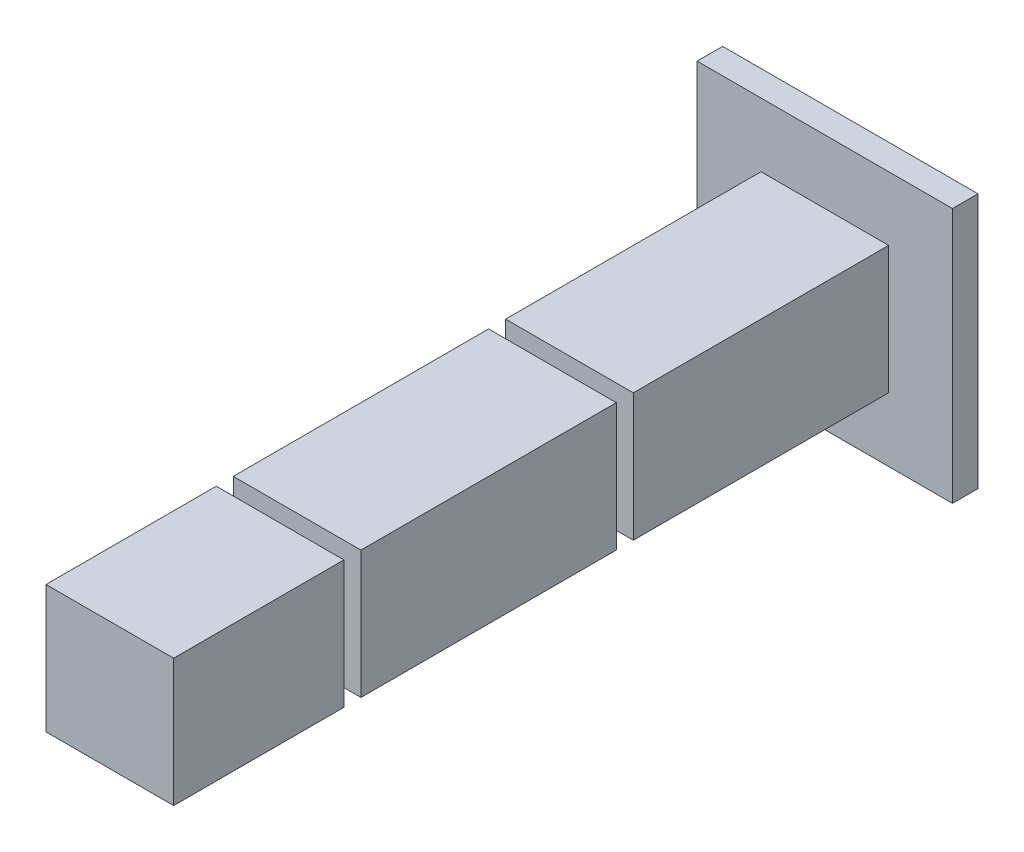
from build123d import *

# Parameters (mm, degrees)
SKETCH1_W           = 150
SKETCH1_H           = 15
BOSS_EXTRUDE1_DEPTH = 150
SKETCH2_W           = 75
SKETCH2_H           = 75
BOSS_EXTRUDE2_DEPTH = 150
SKETCH3_W           = 30
SKETCH3_H           = 30
BOSS_EXTRUDE3_DEPTH = 10
SKETCH4_W           = 75
SKETCH4_H           = 75
BOSS_EXTRUDE4_DEPTH = 150
LPATTERN1_COUNT     = 2
LPATTERN1_PITCH     = 160
SKETCH5_W           = 75
SKETCH5_H           = 75
BOSS_EXTRUDE5_DEPTH = 100


with BuildPart() as part:
    # Sketch1 → Boss-Extrude1 (new body)
    with BuildSketch(Plane.YZ):
        Rectangle(SKETCH1_W, SKETCH1_H)
    extrude(amount=BOSS_EXTRUDE1_DEPTH)

    # Sketch2 → Boss-Extrude2 (add)
    with BuildSketch(Plane.XY.offset(7.5)):
        with Locations((75, 0)):
            Rectangle(SKETCH2_W, SKETCH2_H)
    extrude(amount=BOSS_EXTRUDE2_DEPTH)

    # Sketch3 → Boss-Extrude3 (add)
    with BuildSketch(Plane.XY.offset(157.5)):
        with Locations((75, 0)):
            Rectangle(SKETCH3_W, SKETCH3_H)
    boss_extrude3 = extrude(amount=BOSS_EXTRUDE3_DEPTH)

    # Sketch4 → Boss-Extrude4 (add)
    with BuildSketch(Plane.XY.offset(167.5)):
        with Locations((75, 0)):
            Rectangle(SKETCH4_W, SKETCH4_H)
    extrude(amount=BOSS_EXTRUDE4_DEPTH)

    # LPattern1: Boss-Extrude3 ×2
    with Locations(*[(0, 0, i * LPATTERN1_PITCH) for i in range(1, LPATTERN1_COUNT)]):
        add(boss_extrude3)

    # Sketch5 → Boss-Extrude5 (add)
    with BuildSketch(Plane.XY.offset(327.5)):
        with Locations((75, 0)):
            Rectangle(SKETCH5_W, SKETCH5_H)
    extrude(amount=BOSS_EXTRUDE5_DEPTH)


solid = part.part
